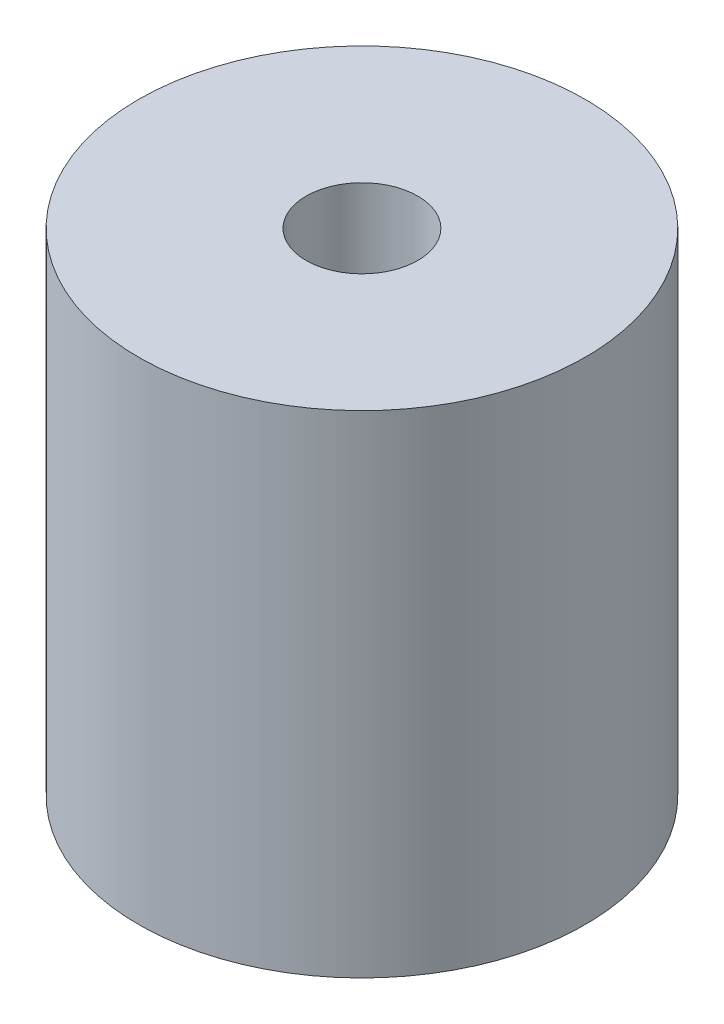
from build123d import *


with BuildPart() as part:
    # 草图1 → 旋转2 (revolve)
    with BuildSketch(Plane.XY):
        Polygon((-13.129708863, 20.698918857), (-5.629708863, 20.698918857), (-5.629708863, 14.698918857), (-9.129708863, 14.698918857), (-9.129708863, -1.301081143), (-13.129708863, -1.301081143), align=None)
    revolve(axis=Axis((-3.129708863, 20.698918857, 0), (0, -1, 0)))


solid = part.part
